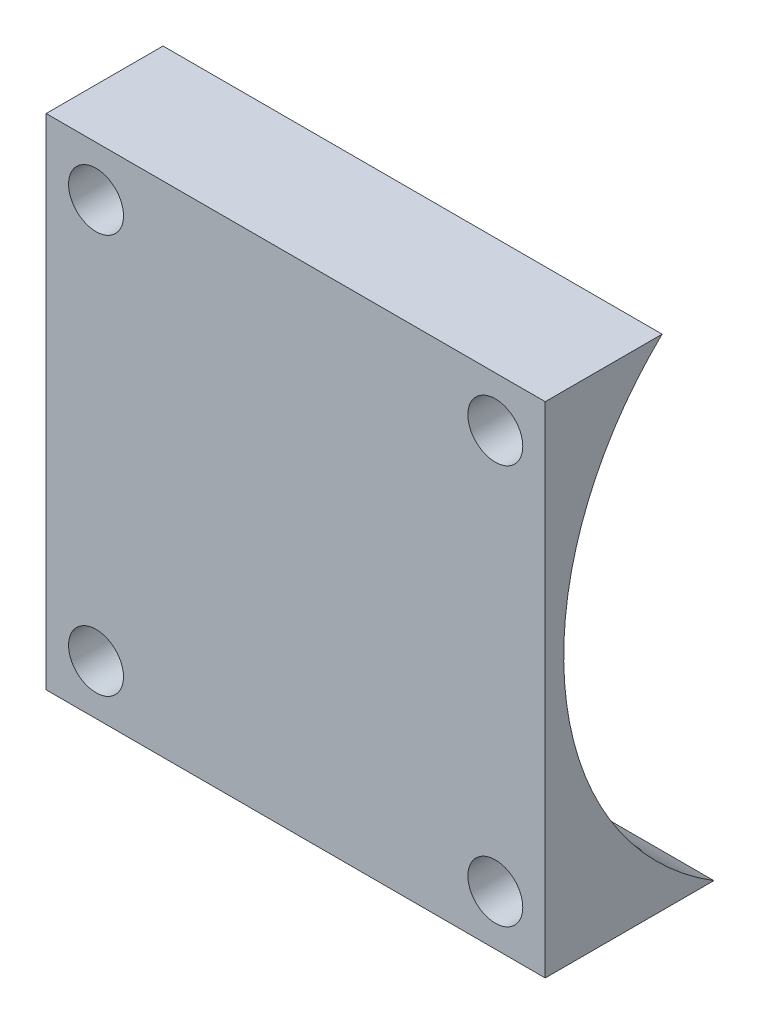
from build123d import *

# Parameters (mm, degrees)
SKETCH1_W               = 50
SKETCH1_H               = 50
SKETCH1_R               = 2.75
BOSS_EXTRUDE1_DEPTH     = 33.6
CUT_EXTRUDE1_DEPTH      = 50.829308645
CUT_EXTRUDE1_DEPTH_BACK = 50.829308645
SKETCH2_R               = 31.75


with BuildPart() as part:
    # Sketch1 → Boss-Extrude1 (new body)
    with BuildSketch(Plane.XY):
        with Locations((0, -2)):
            Rectangle(SKETCH1_W, SKETCH1_H)
        with Locations((-20, 18)):
            Circle(SKETCH1_R, mode=Mode.SUBTRACT)
        with Locations((20, 18)):
            Circle(SKETCH1_R, mode=Mode.SUBTRACT)
        with Locations((20, -22)):
            Circle(SKETCH1_R, mode=Mode.SUBTRACT)
        with Locations((-20, -22)):
            Circle(SKETCH1_R, mode=Mode.SUBTRACT)
    extrude(amount=BOSS_EXTRUDE1_DEPTH)

    # Sketch2 → Cut-Extrude1 (cut, two sides: drawn at the far end of the back side and taken through both)
    with BuildSketch(Plane(origin=(0, 0, 0), x_dir=(0, 0, -1), z_dir=(1, 0, 0)).offset(-CUT_EXTRUDE1_DEPTH_BACK)):
        Circle(SKETCH2_R)
    extrude(amount=CUT_EXTRUDE1_DEPTH + CUT_EXTRUDE1_DEPTH_BACK, mode=Mode.SUBTRACT)


solid = part.part
